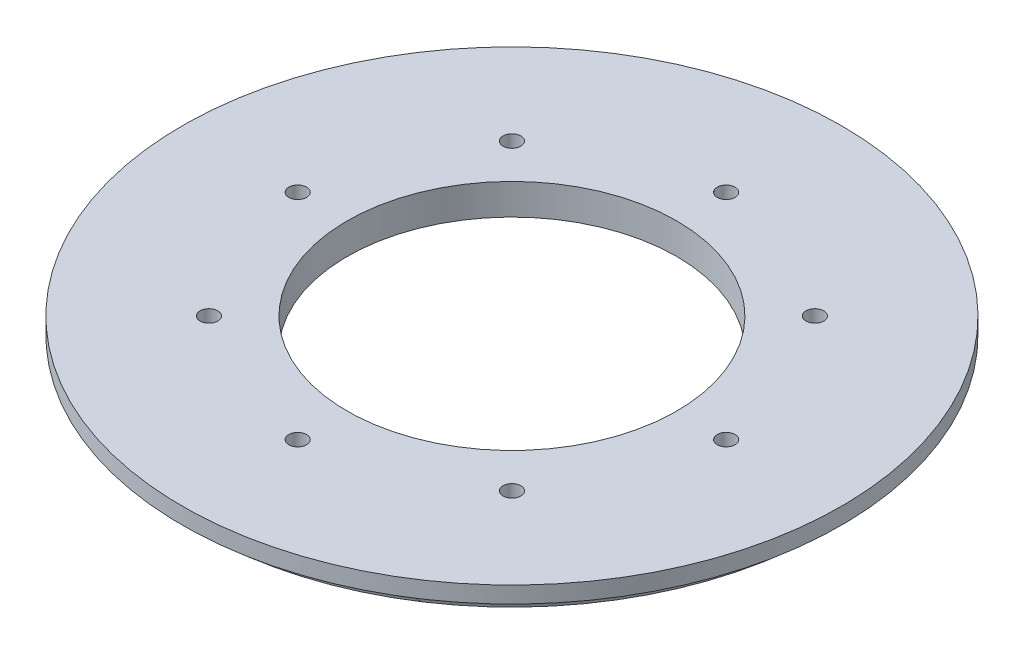
from build123d import *

# Parameters (mm, degrees)
SKETCH2_R          = 1.35
CUT_EXTRUDE1_DEPTH = 71.865707448
SKETCH4_R          = 25
CUT_EXTRUDE2_DEPTH = 71.865707448


with BuildPart() as part:
    # Sketch1 → Revolve1 (revolve)
    with BuildSketch(Plane.XY, mode=Mode.PRIVATE) as revolve1_sk:
        with BuildLine():
            Line((0, 0.315015275), (-47.48443706, 0.315015275))
            ThreePointArc((-47.48443706, 0.315015275), (-48.325204531, 1.887561025), (-50, 2.499811149))
            Line((-50, 2.499811149), (-50, 4.999937053))
            Line((-50, 4.999937053), (0, 4.999937053))
            Line((0, 4.999937053), (0, 0.315015275))
        make_face()
    revolve(revolve1_sk.sketch.rotate(Axis((0, 0.315015275, 0), (0, 1, 0)), 270), axis=Axis((0, 0.315015275, 0), (0, 1, 0)))

    # Sketch2 → Cut-Extrude1 (cut, through all)
    with BuildSketch(Plane(origin=(0, 4.999937053, 0), x_dir=(1, 0, 0), z_dir=(0, 1, 0))):
        with Locations(Location((0, 32.5, 0), (0, 0, 270))):
            Circle(SKETCH2_R)
        with Locations(Location((22.980970389, 22.980970389, 0), (0, 0, 270))):
            Circle(SKETCH2_R)
        with Locations(Location((32.5, 0, 0), (0, 0, 270))):
            Circle(SKETCH2_R)
        with Locations(Location((22.980970389, -22.980970389, 0), (0, 0, 270))):
            Circle(SKETCH2_R)
        with Locations(Location((0, -32.5, 0), (0, 0, 270))):
            Circle(SKETCH2_R)
        with Locations(Location((-22.980970389, -22.980970389, 0), (0, 0, 270))):
            Circle(SKETCH2_R)
        with Locations(Location((-32.5, 0, 0), (0, 0, 270))):
            Circle(SKETCH2_R)
        with Locations(Location((-22.980970389, 22.980970389, 0), (0, 0, 270))):
            Circle(SKETCH2_R)
    extrude(amount=-CUT_EXTRUDE1_DEPTH, mode=Mode.SUBTRACT)

    # Sketch4 → Cut-Extrude2 (cut, through all)
    with BuildSketch(Plane.XZ.offset(-0.315015275)):
        with Locations(Location((0, 0, 0), (0, 0, 270))):
            Circle(SKETCH4_R)
    extrude(amount=-CUT_EXTRUDE2_DEPTH, mode=Mode.SUBTRACT)


solid = part.part
